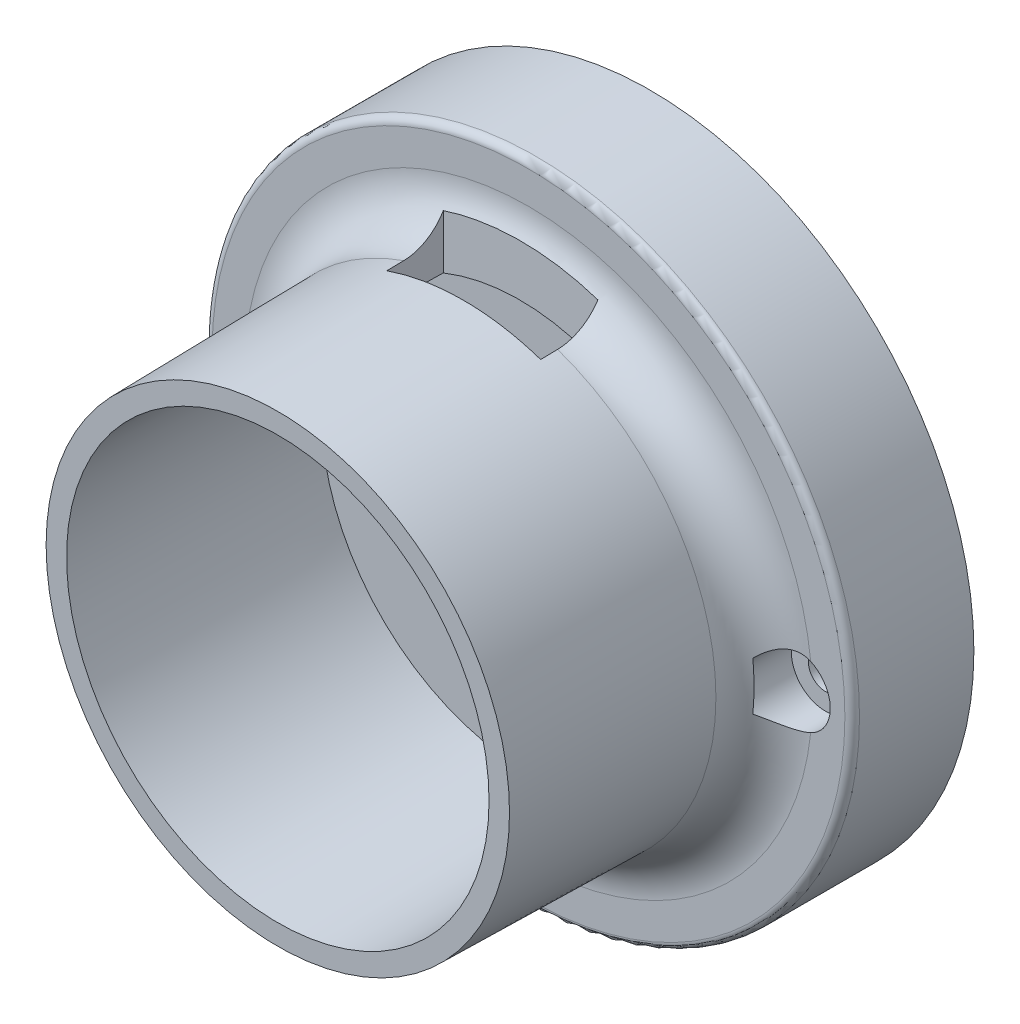
from build123d import *

# Parameters (mm, degrees)
SKETCH1_R           = 13.3
SKETCH1_R_2         = 12.1
BOSS_EXTRUDE1_DEPTH = 3
SKETCH2_R           = 13.3
BOSS_EXTRUDE2_DEPTH = 2
SKETCH3_R           = 4
CUT_EXTRUDE1_DEPTH  = 10.2
SKETCH4_R           = 9.7
SKETCH4_R_2         = 8.5
BOSS_EXTRUDE3_DEPTH = 10.3
BOSS_EXTRUDE3_DRAFT = 1
FILLET1_R           = 2
SKETCH5_R           = 9
SKETCH5_R_2         = 4
BOSS_EXTRUDE4_DEPTH = 0.8
BOSS_EXTRUDE4_DRAFT = 1
BOSS_EXTRUDE5_DEPTH = 3
FILLET2_R           = 0.1
SKETCH7_W           = 6
SKETCH7_H           = 2
CUT_EXTRUDE2_DEPTH  = 20.8
CUT_EXTRUDE2_DRAFT  = -1
SKETCH8_R           = 0.7
CUT_EXTRUDE3_DEPTH  = 20.8
CUT_EXTRUDE4_START  = -0.8
SKETCH9_R           = 1.4
SKETCH9_R_2         = 1.5
CUT_EXTRUDE4_DEPTH  = 2
FILLET3_R           = 0.3


with BuildPart() as part:
    # Sketch1 → Boss-Extrude1 (new body)
    with BuildSketch(Plane.XY):
        Circle(SKETCH1_R)
        Circle(SKETCH1_R_2, mode=Mode.SUBTRACT)
    extrude(amount=BOSS_EXTRUDE1_DEPTH)

    # Sketch2 → Boss-Extrude2 (add)
    with BuildSketch(Plane.XY.offset(3)):
        Circle(SKETCH2_R)
    extrude(amount=BOSS_EXTRUDE2_DEPTH)

    # Sketch3 → Cut-Extrude1 (cut)
    with BuildSketch(Plane.XY.offset(5)):
        Circle(SKETCH3_R)
    extrude(amount=-CUT_EXTRUDE1_DEPTH, mode=Mode.SUBTRACT)


with BuildPart() as boss_extrude3_tool:
    # Sketch4 → Boss-Extrude3 (with draft: the straight prism first)
    with BuildSketch(Plane.XY.offset(5)):
        Circle(SKETCH4_R)
        Circle(SKETCH4_R_2, mode=Mode.SUBTRACT)
    extrude(amount=BOSS_EXTRUDE3_DEPTH)
    # Boss-Extrude3: the draft: its side faces are tilted about the plane it starts from
    boss_extrude3_sides = [boss_extrude3_tool.faces().sort_by_distance(p)[0] for p in [
        (-9.7, 0, 10.15),
        (-8.5, 0, 10.15),
    ]]
    draft(boss_extrude3_sides, Plane.XY.offset(5), BOSS_EXTRUDE3_DRAFT)


with BuildPart() as part_1:
    add(part.part)

    # Boss-Extrude3: add boss_extrude3_tool
    add(boss_extrude3_tool.part)

    # Fillet1
    fillet1_edges = [part_1.edges().sort_by_distance(p)[0] for p in [
        (-9.7, 0, 5),
    ]]
    fillet(fillet1_edges, radius=FILLET1_R)


with BuildPart() as boss_extrude4_tool:
    # Sketch5 → Boss-Extrude4 (with draft: the straight prism first)
    with BuildSketch(Plane(origin=(0, 0, 3), x_dir=(-1, 0, 0), z_dir=(0, 0, -1))):
        Circle(SKETCH5_R)
        with Locations(Location((0, 0, 0), (0, 0, 180))):
            Circle(SKETCH5_R_2, mode=Mode.SUBTRACT)
    extrude(amount=BOSS_EXTRUDE4_DEPTH)
    # Boss-Extrude4: the draft: its side faces are tilted about the plane it starts from
    boss_extrude4_sides = [boss_extrude4_tool.faces().sort_by_distance(p)[0] for p in [
        (9, 0, 2.6),
        (-4, 0, 2.6),
    ]]
    draft(boss_extrude4_sides, Plane(origin=(0, 0, 3), x_dir=(-1, 0, 0), z_dir=(0, 0, -1)), BOSS_EXTRUDE4_DRAFT)


with BuildPart() as part_2:
    add(part_1.part)

    # Boss-Extrude4: add boss_extrude4_tool
    add(boss_extrude4_tool.part)

    # Sketch6 → Boss-Extrude5 (add)
    with BuildSketch(Plane(origin=(0, 0, 0), x_dir=(-1, 0, 0), z_dir=(0, 0, -1))):
        with BuildLine():
            Line((3.029598049, 11.714586449), (2.804256045, 10.843253572))
            ThreePointArc((2.804256045, 10.843253572), (0, 11.2), (-2.804256045, 10.843253572))
            Line((-2.804256045, 10.843253572), (-3.029598049, 11.714586449))
            ThreePointArc((-3.029598049, 11.714586449), (0, 12.1), (3.029598049, 11.714586449))
        make_face()
    extrude(amount=-BOSS_EXTRUDE5_DEPTH)

    # Fillet2
    fillet2_edges = [part_2.edges().sort_by_distance(p)[0] for p in [
        (-3.029598049, 11.714586449, 1.5),
        (3.029598049, 11.714586449, 1.5),
        (2.804256045, 10.843253572, 1.5),
        (-2.804256045, 10.843253572, 1.5),
    ]]
    fillet(fillet2_edges, radius=FILLET2_R)


with BuildPart() as cut_extrude2_tool:
    # Sketch7 → Cut-Extrude2 (with draft: the straight prism first)
    with BuildSketch(Plane(origin=(0, 0, 0), x_dir=(1, 0, 0), z_dir=(0, 1, 0))):
        with Locations((0, -6.5)):
            Rectangle(SKETCH7_W, SKETCH7_H)
    extrude(amount=CUT_EXTRUDE2_DEPTH)
    # Cut-Extrude2: the draft: its side faces are tilted about the plane it starts from
    cut_extrude2_sides = [cut_extrude2_tool.faces().sort_by_distance(p)[0] for p in [
        (0, 10.4, 7.5),
        (3, 10.4, 6.5),
        (0, 10.4, 5.5),
        (-3, 10.4, 6.5),
    ]]
    draft(cut_extrude2_sides, Plane(origin=(0, 0, 0), x_dir=(1, 0, 0), z_dir=(0, 1, 0)), CUT_EXTRUDE2_DRAFT)


with BuildPart() as part_3:
    add(part_2.part)

    # Cut-Extrude2: cut by cut_extrude2_tool
    add(cut_extrude2_tool.part, mode=Mode.SUBTRACT)

    # Sketch8 → Cut-Extrude3 (cut)
    with BuildSketch(Plane(origin=(0, 0, 3), x_dir=(-1, 0, 0), z_dir=(0, 0, -1))):
        with Locations((-11, 0)):
            Circle(SKETCH8_R)
        with Locations(Location((11, 0, 0), (0, 0, 341.351023891))):
            Circle(SKETCH8_R)
    extrude(amount=-CUT_EXTRUDE3_DEPTH, mode=Mode.SUBTRACT)

    # Sketch9 → Cut-Extrude4 (cut)
    with BuildSketch(Plane(origin=(0, 0, 3), x_dir=(-1, 0, 0), z_dir=(0, 0, -1)).offset(CUT_EXTRUDE4_START)):
        with Locations((-11, 0)):
            Circle(SKETCH9_R)
        with Locations((11, 0)):
            Circle(SKETCH9_R_2)
    extrude(amount=-CUT_EXTRUDE4_DEPTH, mode=Mode.SUBTRACT)

    # Fillet3
    fillet3_edges = [part_3.edges().sort_by_distance(p)[0] for p in [
        (-13.3, 0, 5),
    ]]
    fillet(fillet3_edges, radius=FILLET3_R)


solid = part_3.part
